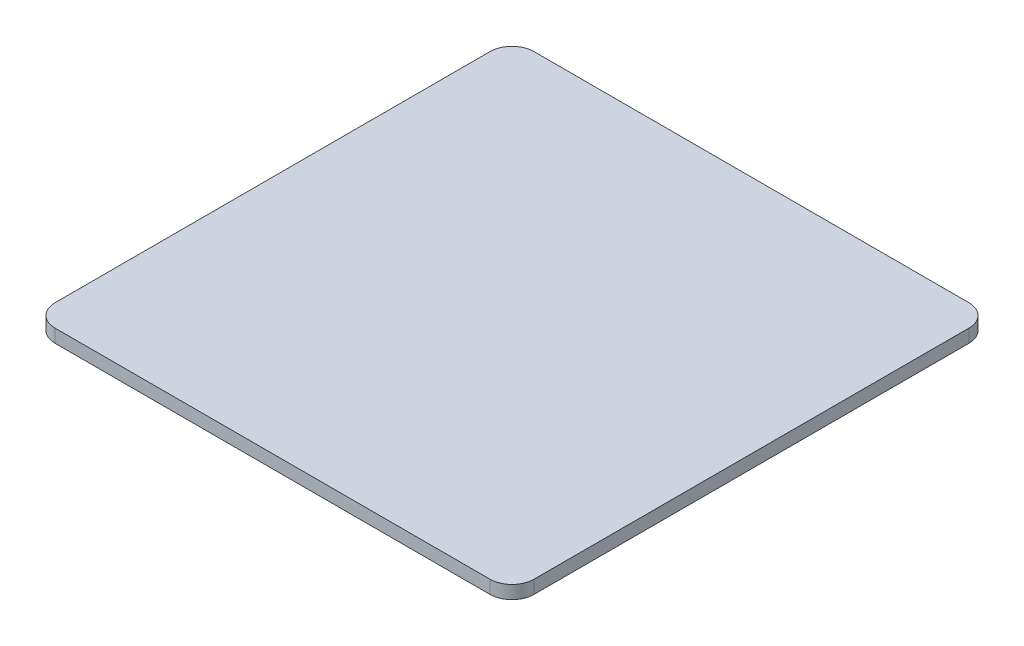
from build123d import *

# Parameters (mm, degrees)
BOSS_EXTRU_1_DEPTH = 6


with BuildPart() as part:
    # Esquisse1 → Boss.-Extru.1 (new body)
    with BuildSketch(Plane(origin=(0, 0, 0), x_dir=(1, 0, 0), z_dir=(0, 1, 0))):
        with BuildLine():
            Line((10, 0), (208, 0))
            ThreePointArc((208, 0), (215.071067812, 2.928932188), (218, 10))
            Line((218, 10), (218, 208))
            ThreePointArc((218, 208), (215.071067812, 215.071067812), (208, 218))
            Line((208, 218), (10, 218))
            ThreePointArc((10, 218), (2.928932188, 215.071067812), (0, 208))
            Line((0, 208), (0, 10))
            ThreePointArc((0, 10), (2.928932188, 2.928932188), (10, 0))
        make_face()
    extrude(amount=BOSS_EXTRU_1_DEPTH)


solid = part.part
